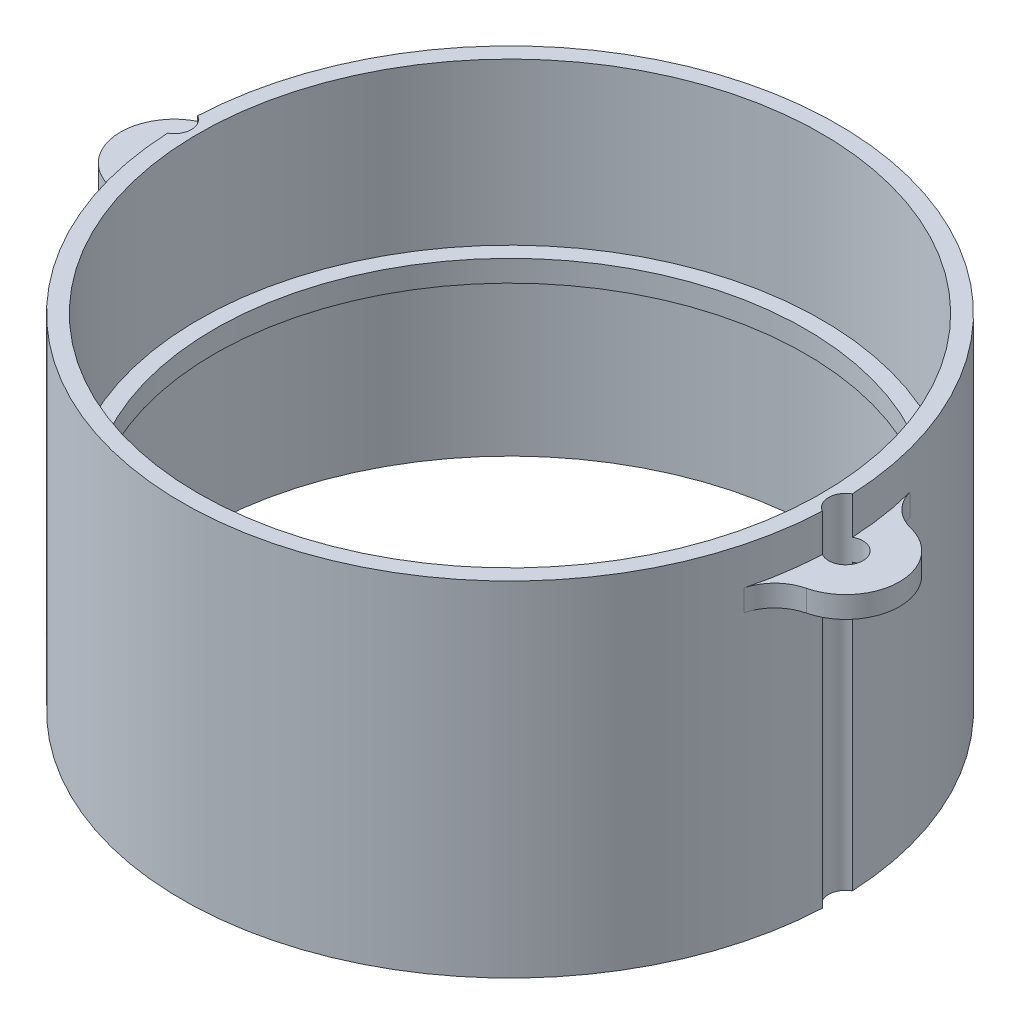
from build123d import *

# Parameters (mm, degrees)
SKETCH1_R           = 30.5
SKETCH1_R_2         = 29
BOSS_EXTRUDE1_DEPTH = 15
SKETCH2_R           = 30.5
SKETCH2_R_2         = 27.5
BOSS_EXTRUDE2_DEPTH = 2
SKETCH3_R           = 30.5
SKETCH3_R_2         = 29
BOSS_EXTRUDE3_DEPTH = 15
BOSS_EXTRUDE4_DEPTH = 2
SKETCH5_R           = 1.6
CUT_EXTRUDE1_DEPTH  = 40


with BuildPart() as part:
    # Sketch1 → Boss-Extrude1 (new body)
    with BuildSketch(Plane(origin=(0, 0, 0), x_dir=(1, 0, 0), z_dir=(0, 1, 0))):
        with Locations(Location((0, 0, 0), (0, 0, 270))):
            Circle(SKETCH1_R)
        with Locations(Location((0, 0, 0), (0, 0, 270))):
            Circle(SKETCH1_R_2, mode=Mode.SUBTRACT)
    extrude(amount=BOSS_EXTRUDE1_DEPTH)

    # Sketch2 → Boss-Extrude2 (add)
    with BuildSketch(Plane(origin=(0, 15, 0), x_dir=(1, 0, 0), z_dir=(0, 1, 0))):
        with Locations(Location((0, 0, 0), (0, 0, 270))):
            Circle(SKETCH2_R)
        with Locations(Location((0, 0, 0), (0, 0, 270))):
            Circle(SKETCH2_R_2, mode=Mode.SUBTRACT)
    extrude(amount=BOSS_EXTRUDE2_DEPTH)

    # Sketch3 → Boss-Extrude3 (add)
    with BuildSketch(Plane(origin=(0, 17, 0), x_dir=(1, 0, 0), z_dir=(0, 1, 0))):
        with Locations(Location((0, 0, 0), (0, 0, 270))):
            Circle(SKETCH3_R)
        with Locations(Location((0, 0, 0), (0, 0, 270))):
            Circle(SKETCH3_R_2, mode=Mode.SUBTRACT)
    extrude(amount=BOSS_EXTRUDE3_DEPTH)

    # Sketch4 → Boss-Extrude4 (add)
    with BuildSketch(Plane(origin=(0, 26.5, 0), x_dir=(1, 0, 0), z_dir=(0, 1, 0))):
        with BuildLine():
            ThreePointArc((-32.429444444, -4.858900164), (-30.570387885, -5.892011652), (-29.503666667, -7.731988956))
            ThreePointArc((-29.503666667, -7.731988956), (-30.249891184, -3.897958868), (-30.5, 0))
            ThreePointArc((-30.5, 0), (-30.249891184, 3.897958868), (-29.503666667, 7.731988956))
            ThreePointArc((-29.503666667, 7.731988956), (-30.570387885, 5.892011652), (-32.429444444, 4.858900164))
            ThreePointArc((-32.429444444, 4.858900164), (-36.25, 0), (-32.429444444, -4.858900164))
        make_face()
    boss_extrude4 = extrude(amount=BOSS_EXTRUDE4_DEPTH)

    # Sketch5 → Cut-Extrude1 (cut)
    with BuildSketch(Plane(origin=(0, 32, 0), x_dir=(1, 0, 0), z_dir=(0, 1, 0))):
        with Locations(Location((-31.25, 0, 0), (0, 0, 299.256813925))):
            Circle(SKETCH5_R)
    cut_extrude1 = extrude(amount=-CUT_EXTRUDE1_DEPTH, mode=Mode.SUBTRACT)

    # Mirror1: Boss-Extrude4, Cut-Extrude1 across plane
    add(boss_extrude4.mirror(Plane(origin=(0, 0, 0), x_dir=(0, 0, 1), z_dir=(1, 0, 0))))
    add(cut_extrude1.mirror(Plane(origin=(0, 0, 0), x_dir=(0, 0, 1), z_dir=(1, 0, 0))), mode=Mode.SUBTRACT)


solid = part.part
